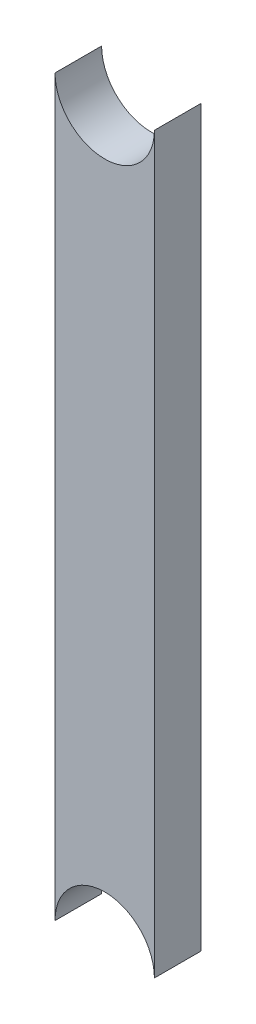
from build123d import *

# Parameters (mm, degrees)
BOSS_EXTRUDE3_DEPTH = 3


with BuildPart() as part:
    # Sketch1 → Boss-Extrude3 (new body)
    with BuildSketch(Plane.XY):
        with BuildLine():
            Line((-3.2, 0), (-3.2, 47.2744))
            ThreePointArc((-3.2, 47.2744), (0, 44.0744), (3.2, 47.2744))
            Line((3.2, 47.2744), (3.2, 0))
            ThreePointArc((3.2, 0), (0, 3.2), (-3.2, 0))
        make_face()
    extrude(amount=BOSS_EXTRUDE3_DEPTH)


solid = part.part
